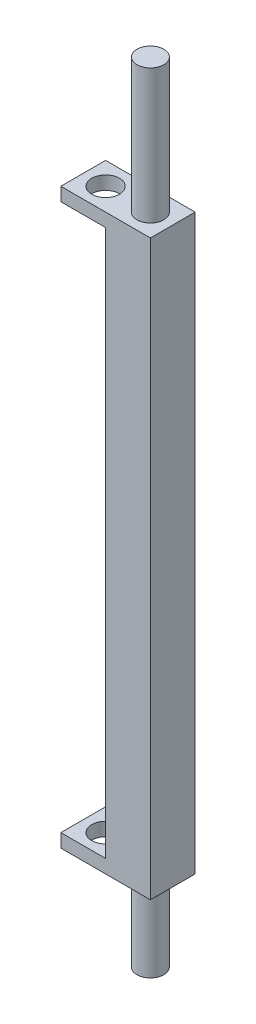
from build123d import *

# Parameters (mm, degrees)
SKETCH_2_W          = 10
SKETCH_2_H          = 5
EXTRUDE_1_DEPTH     = 1.5
SKETCH_3_R          = 1.55
CUT_EXTRUDE_1_DEPTH = 1.5
SKETCH_4_W          = 5
SKETCH_4_H          = 5
EXTRUDE_2_DEPTH     = 61
SKETCH_5_W          = 10
SKETCH_5_H          = 5
EXTRUDE_3_DEPTH     = 1.5
SKETCH_6_R          = 1.55
CUT_EXTRUDE_2_DEPTH = 1.5
SKETCH_7_R          = 1.5
EXTRUDE_4_DEPTH     = 15
EXTRUDE_START       = 9
SKETCH_11_R         = 1.5
EXTRUDE_5_DEPTH     = 9


with BuildPart() as part:
    # 草图2 → 凸台-拉伸1 (new body)
    with BuildSketch(Plane(origin=(0, 0, 0), x_dir=(1, 0, 0), z_dir=(0, 1, 0))):
        Rectangle(SKETCH_2_W, SKETCH_2_H)
    extrude(amount=EXTRUDE_1_DEPTH)

    # 草图3 → 切除-拉伸1 (cut)
    with BuildSketch(Plane.XZ):
        with Locations(Location((-2.5, 0, 0), (0, 0, 270))):
            Circle(SKETCH_3_R)
    extrude(amount=-CUT_EXTRUDE_1_DEPTH, mode=Mode.SUBTRACT)

    # 草图4 → 凸台-拉伸2 (add)
    with BuildSketch(Plane.XZ):
        with Locations((2.5, 0)):
            Rectangle(SKETCH_4_W, SKETCH_4_H)
    extrude(amount=EXTRUDE_2_DEPTH)

    # 草图5 → 凸台-拉伸3 (add)
    with BuildSketch(Plane.XZ.offset(61)):
        Rectangle(SKETCH_5_W, SKETCH_5_H)
    extrude(amount=EXTRUDE_3_DEPTH)

    # 草图6 → 切除-拉伸2 (cut)
    with BuildSketch(Plane.XZ.offset(62.5)):
        with Locations(Location((-2.5, 0, 0), (0, 0, 270))):
            Circle(SKETCH_6_R)
    extrude(amount=-CUT_EXTRUDE_2_DEPTH, mode=Mode.SUBTRACT)

    # 草图7 → 凸台-拉伸4 (add)
    with BuildSketch(Plane(origin=(0, 1.5, 0), x_dir=(1, 0, 0), z_dir=(0, 1, 0))):
        with Locations(Location((2.5, 0, 0), (0, 0, 270))):
            Circle(SKETCH_7_R)
    extrude(amount=EXTRUDE_4_DEPTH)

    # 草图11 → 凸台-拉伸5 (add)
    with BuildSketch(Plane.XZ.offset(62.5).offset(EXTRUDE_START)):
        with Locations(Location((2.5, 0, 0), (0, 0, 90))):
            Circle(SKETCH_11_R)
    extrude(amount=-EXTRUDE_5_DEPTH)


solid = part.part
